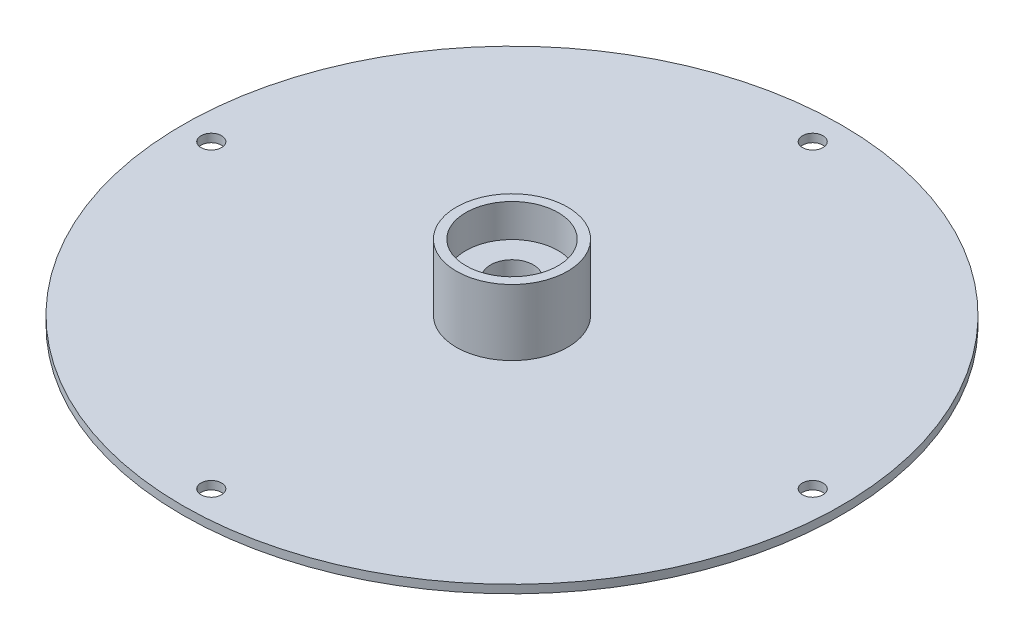
from build123d import *

# Parameters (mm, degrees)
SKETCH1_R           = 80
SKETCH1_R_2         = 5.2
BOSS_EXTRUDE1_DEPTH = 2
SKETCH2_R           = 2.5
CUT_EXTRUDE1_DEPTH  = 114.154761279
SKETCH3_R           = 13.5
SKETCH3_R_2         = 5.2
BOSS_EXTRUDE2_DEPTH = 8
SKETCH4_R           = 13.5
SKETCH4_R_2         = 11.2
BOSS_EXTRUDE3_DEPTH = 8


with BuildPart() as part:
    # Sketch1 → Boss-Extrude1 (new body)
    with BuildSketch(Plane(origin=(0, 0, 0), x_dir=(1, 0, 0), z_dir=(0, 1, 0))):
        with Locations(Location((0, 0, 0), (0, 0, 270))):
            Circle(SKETCH1_R)
        with Locations(Location((0, 0, 0), (0, 0, 270))):
            Circle(SKETCH1_R_2, mode=Mode.SUBTRACT)
    extrude(amount=BOSS_EXTRUDE1_DEPTH)

    # Sketch2 → Cut-Extrude1 (cut, through all)
    with BuildSketch(Plane(origin=(0, 2, 0), x_dir=(1, 0, 0), z_dir=(0, 1, 0))):
        with Locations(Location((0, 73, 0), (0, 0, 270))):
            Circle(SKETCH2_R)
        with Locations(Location((73, 0, 0), (0, 0, 270))):
            Circle(SKETCH2_R)
        with Locations(Location((0, -73, 0), (0, 0, 270))):
            Circle(SKETCH2_R)
        with Locations(Location((-73, 0, 0), (0, 0, 270))):
            Circle(SKETCH2_R)
    extrude(amount=-CUT_EXTRUDE1_DEPTH, mode=Mode.SUBTRACT)

    # Sketch3 → Boss-Extrude2 (add)
    with BuildSketch(Plane(origin=(0, 2, 0), x_dir=(1, 0, 0), z_dir=(0, 1, 0))):
        with Locations(Location((0, 0, 0), (0, 0, 270))):
            Circle(SKETCH3_R)
        with Locations(Location((0, 0, 0), (0, 0, 270))):
            Circle(SKETCH3_R_2, mode=Mode.SUBTRACT)
    extrude(amount=BOSS_EXTRUDE2_DEPTH)

    # Sketch4 → Boss-Extrude3 (add)
    with BuildSketch(Plane(origin=(0, 10, 0), x_dir=(1, 0, 0), z_dir=(0, 1, 0))):
        with Locations(Location((0, 0, 0), (0, 0, 270))):
            Circle(SKETCH4_R)
        with Locations(Location((0, 0, 0), (0, 0, 270))):
            Circle(SKETCH4_R_2, mode=Mode.SUBTRACT)
    extrude(amount=BOSS_EXTRUDE3_DEPTH)


solid = part.part
